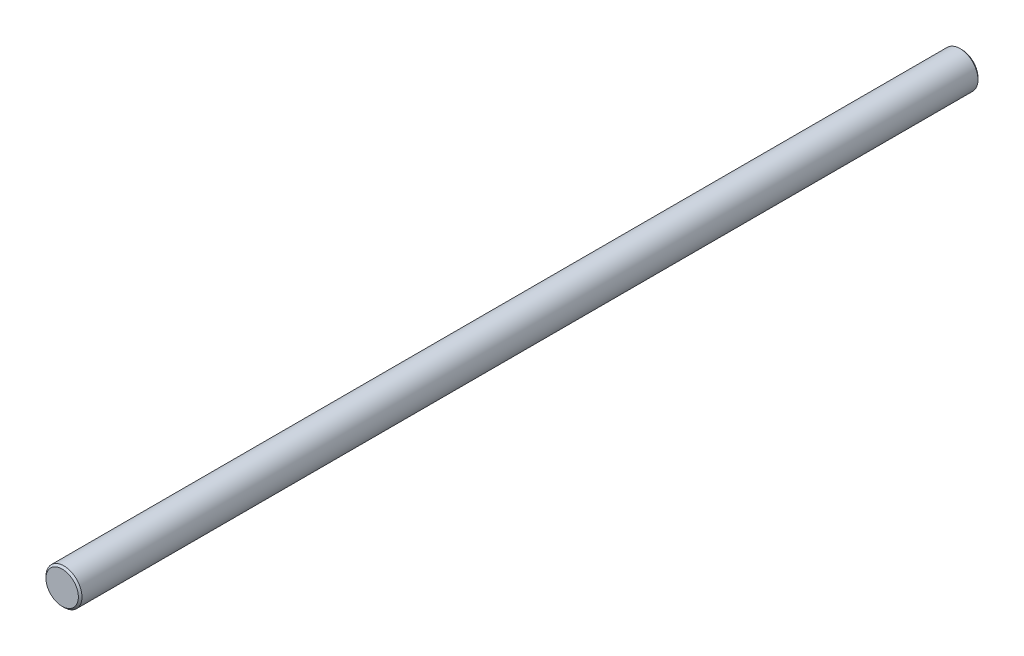
from build123d import *

# Parameters (mm, degrees)
ESQUISSE1_R        = 10
BOSS_EXTRU_1_DEPTH = 500
CHANFREIN1_SIZE    = 1


with BuildPart() as part:
    # Esquisse1 → Boss.-Extru.1 (new body)
    with BuildSketch(Plane.XY):
        Circle(ESQUISSE1_R)
    extrude(amount=BOSS_EXTRU_1_DEPTH)

    # Chanfrein1
    chanfrein1_edges = [part.edges().sort_by_distance(p)[0] for p in [
        (-10, 0, 0),
        (-10, 0, 500),
    ]]
    chamfer(chanfrein1_edges, length=CHANFREIN1_SIZE)


solid = part.part
